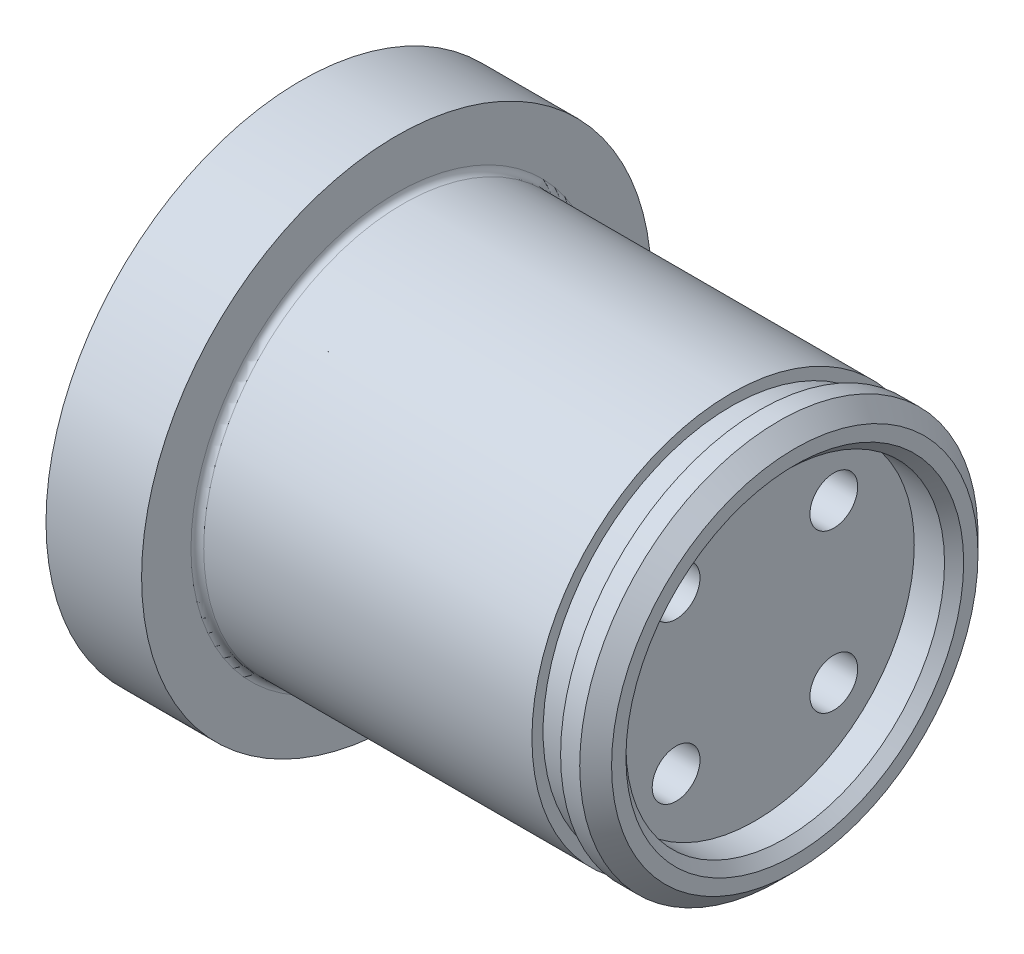
from build123d import *

# Parameters (mm, degrees)
SKETCH_2_W               = 1.8
SKETCH_2_H               = 0.7
CHAMFER_1_SIZE           = 1
FILLET_1_R               = 0.4
HOLE_WIZARD_1_D          = 3
PATTERN_CIRCULAR_1_COUNT = 4
SKETCH_5_W               = 2.5
SKETCH_5_H               = 10
CHAMFER_2_SIZE           = 0.6


with BuildPart() as part:
    # Эскиз1 → Повернуть1 (revolve)
    with BuildSketch(Plane.XY, mode=Mode.PRIVATE) as revolve_1_sk:
        Polygon((0, 0), (0, 12.5), (-25, 12.5), (-25, 16), (-31, 16), (-31, 0), align=None)
    revolve(revolve_1_sk.sketch.rotate(Axis((0, 0, 0), (1, 0, 0)), 90), axis=Axis((0, 0, 0), (1, 0, 0)))

    # Эскиз2 → Вырез-Повернуть1 (revolve, cut)
    with BuildSketch(Plane.XY, mode=Mode.PRIVATE) as cut_revolve_1_sk:
        with Locations((-3.1, 12.15)):
            Rectangle(SKETCH_2_W, SKETCH_2_H)
    revolve(cut_revolve_1_sk.sketch.rotate(Axis((0, 0, 0), (-1, 0, 0)), 270), axis=Axis((0, 0, 0), (-1, 0, 0)), mode=Mode.SUBTRACT)

    # Фаска1
    chamfer_1_edges = [part.edges().sort_by_distance(p)[0] for p in [
        (0, 0, -12.5),
    ]]
    chamfer(chamfer_1_edges, length=CHAMFER_1_SIZE)

    # Скругление1
    fillet_1_edges = [part.edges().sort_by_distance(p)[0] for p in [
        (-25, 0, -12.5),
    ]]
    fillet(fillet_1_edges, radius=FILLET_1_R)

    # Отверстие1 (through all)
    with Locations(Plane(origin=(0, 0, 0), x_dir=(0, 0, -1), z_dir=(1, 0, 0))):
        with Locations((4.949747468, 4.949747468)):
            hole_wizard_1 = Hole(HOLE_WIZARD_1_D / 2)

    # Круговой массив1: Отверстие1 ×4 about axis
    pattern_circular_1_axis = Axis((0, 0, 0), (1, 0, 0))
    for i in range(1, PATTERN_CIRCULAR_1_COUNT):
        add(hole_wizard_1.rotate(pattern_circular_1_axis, i * 360 / PATTERN_CIRCULAR_1_COUNT), mode=Mode.SUBTRACT)

    # Эскиз5 → Вырез-Повернуть2 (revolve, cut)
    with BuildSketch(Plane.XY, mode=Mode.PRIVATE) as cut_revolve_2_sk:
        with Locations((-1.25, 5)):
            Rectangle(SKETCH_5_W, SKETCH_5_H)
    revolve(cut_revolve_2_sk.sketch.rotate(Axis((0, 0, 0), (-1, 0, 0)), 90), axis=Axis((0, 0, 0), (-1, 0, 0)), mode=Mode.SUBTRACT)

    # Фаска2
    chamfer_2_edges = [part.edges().sort_by_distance(p)[0] for p in [
        (0, 0, 10),
    ]]
    chamfer(chamfer_2_edges, length=CHAMFER_2_SIZE)


solid = part.part
